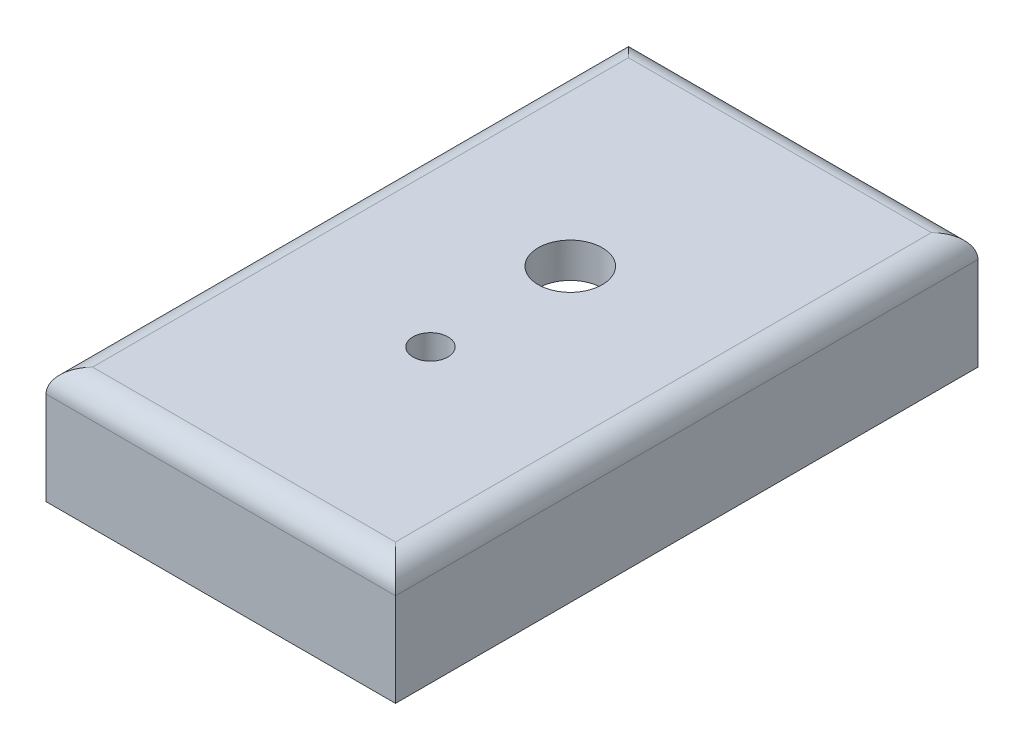
from build123d import *

# Parameters (mm, degrees)
SKETCH1_W           = 30
SKETCH1_H           = 50
BOSS_EXTRUDE1_DEPTH = 10
SHELL1_T            = -3
CUT_EXTRUDE1_REACH  = 32.822
SKETCH2_R           = 1.5
SKETCH2_R_2         = 2.75
CUT_EXTRUDE2_REACH  = 42.311
SKETCH3_W           = 20
SKETCH3_H           = 5
FILLET1_R           = 2
FILLET2_R           = 2


with BuildPart() as part:
    # Sketch1 → Boss-Extrude1 (new body)
    with BuildSketch(Plane(origin=(0, 0, 0), x_dir=(1, 0, 0), z_dir=(0, 1, 0))):
        Rectangle(SKETCH1_W, SKETCH1_H)
    extrude(amount=BOSS_EXTRUDE1_DEPTH)

    # Shell1
    shell1_openings = [part.faces().sort_by_distance(p)[0] for p in [
        (0, 0, 0),
    ]]
    offset(amount=SHELL1_T, openings=shell1_openings, kind=Kind.INTERSECTION)

    # Sketch2 → Cut-Extrude1 (cut, up to next)
    with BuildSketch(Plane(origin=(0, 10, 0), x_dir=(1, 0, 0), z_dir=(0, 1, 0)), mode=Mode.PRIVATE) as cut_extrude1_sk1:
        with Locations(Location((0, -7, 0), (0, 0, 270))):
            Circle(SKETCH2_R)
    cut_extrude1_tool1 = extrude(cut_extrude1_sk1.sketch, amount=-CUT_EXTRUDE1_REACH, mode=Mode.PRIVATE) & part.part
    # Sketch2 → Cut-Extrude1 (cut, up to next)
    with BuildSketch(Plane(origin=(0, 10, 0), x_dir=(1, 0, 0), z_dir=(0, 1, 0)), mode=Mode.PRIVATE) as cut_extrude1_sk2:
        with Locations(Location((0, 5, 0), (0, 0, 270))):
            Circle(SKETCH2_R_2)
    cut_extrude1_tool2 = extrude(cut_extrude1_sk2.sketch, amount=-CUT_EXTRUDE1_REACH, mode=Mode.PRIVATE) & part.part
    add(cut_extrude1_tool1.solids().sort_by_distance((0, 10, 7))[0], mode=Mode.SUBTRACT)
    add(cut_extrude1_tool2.solids().sort_by_distance((0, 10, -5))[0], mode=Mode.SUBTRACT)

    # Sketch3 → Cut-Extrude2 (cut, up to next)
    with BuildSketch(Plane.ZY.offset(15), mode=Mode.PRIVATE) as cut_extrude2_sk1:
        with Locations((0, 2.5)):
            Rectangle(SKETCH3_W, SKETCH3_H)
    cut_extrude2_tool1 = extrude(cut_extrude2_sk1.sketch, amount=-CUT_EXTRUDE2_REACH, mode=Mode.PRIVATE) & part.part
    add(cut_extrude2_tool1.solids().sort_by_distance((-15, 2.5, 0))[0], mode=Mode.SUBTRACT)

    # Fillet1
    fillet1_edges = [part.edges().sort_by_distance(p)[0] for p in [
        (-13.5, 5, -10),
        (-13.5, 0, -10),
        (-13.5, 0, 10),
        (-13.5, 5, 10),
    ]]
    fillet(fillet1_edges, radius=FILLET1_R)

    # Fillet2
    fillet2_edges = [part.edges().sort_by_distance(p)[0] for p in [
        (-15, 10, 0),
        (0, 10, 25),
        (15, 10, 0),
        (0, 10, -25),
    ]]
    fillet(fillet2_edges, radius=FILLET2_R)


solid = part.part
